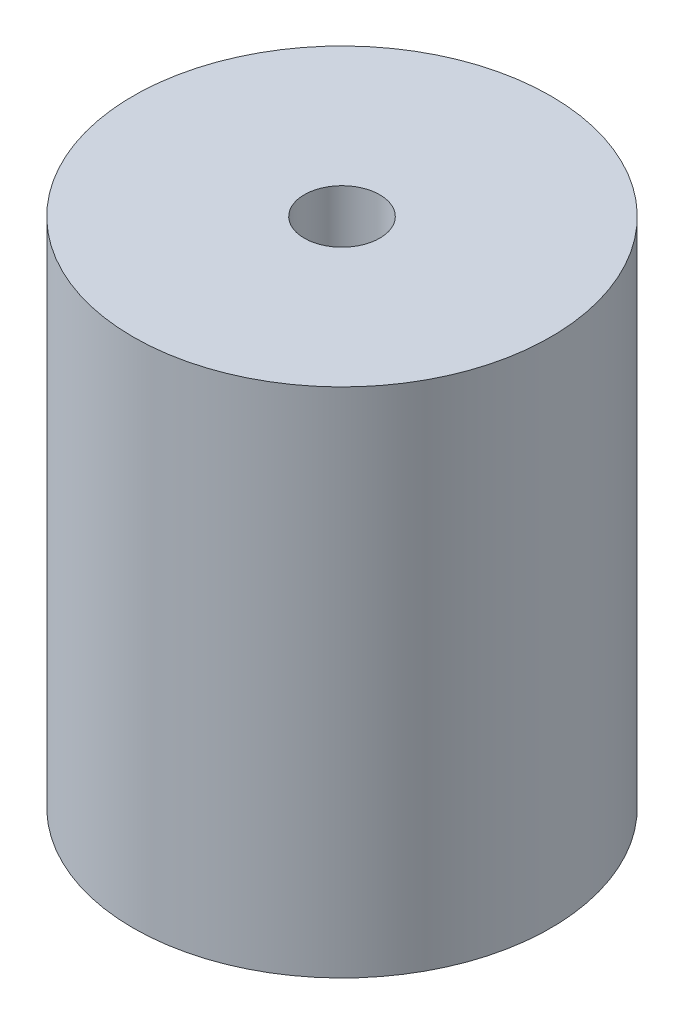
from build123d import *

# Parameters (mm, degrees)
SKETCH_1_R      = 7.75
SKETCH_1_R_2    = 1.4
EXTRUDE_1_DEPTH = 19


with BuildPart() as part:
    # 草图1 → 凸台-拉伸1 (new body)
    with BuildSketch(Plane(origin=(0, 0, 0), x_dir=(1, 0, 0), z_dir=(0, 1, 0))):
        with Locations(Location((0, 0, 0), (0, 0, 270))):
            Circle(SKETCH_1_R)
        with Locations(Location((0, 0, 0), (0, 0, 270))):
            Circle(SKETCH_1_R_2, mode=Mode.SUBTRACT)
    extrude(amount=EXTRUDE_1_DEPTH)


solid = part.part
